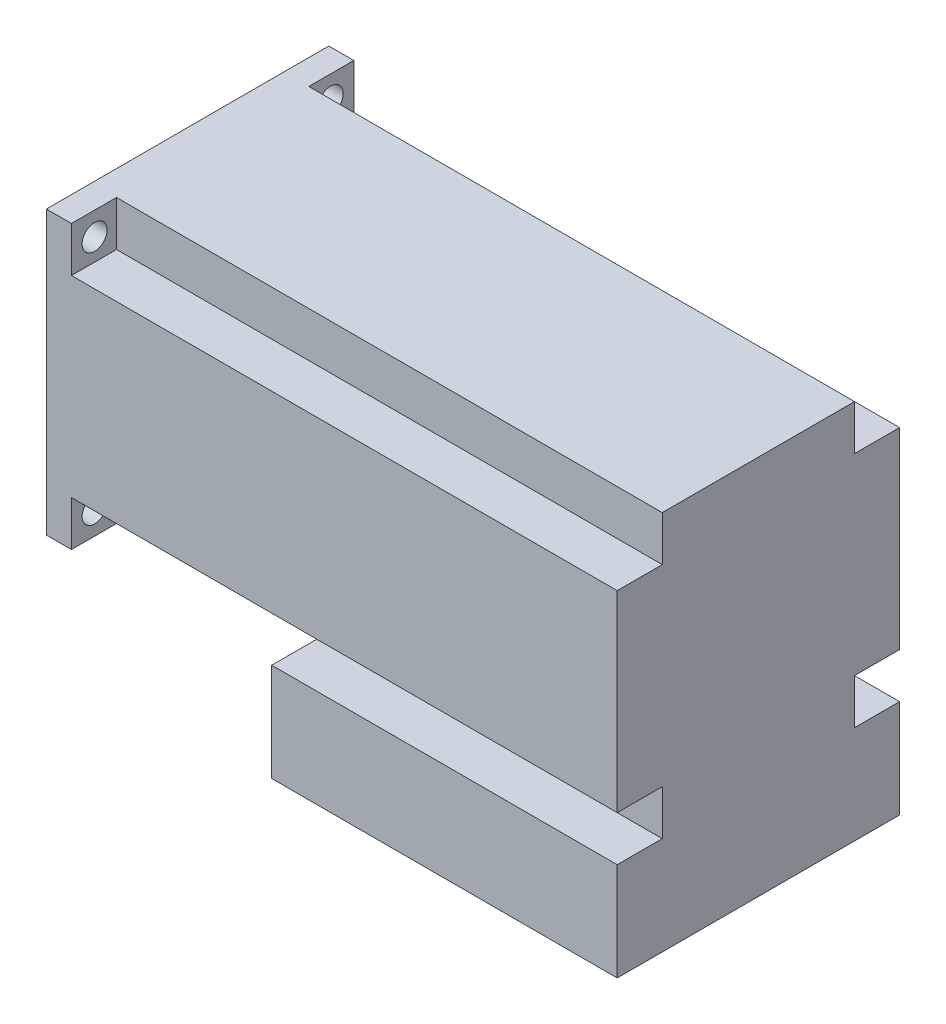
from build123d import *

# Parameters (mm, degrees)
BOSS_EXTRUDE1_DEPTH = 56.4
SKETCH2_R           = 2.5
CUT_EXTRUDE1_DEPTH  = 5
SKETCH3_R           = 3.175
BOSS_EXTRUDE2_DEPTH = 20
SKETCH4_W           = 9
SKETCH4_H           = 9
CUT_EXTRUDE2_DEPTH  = 109


with BuildPart() as part:
    # Sketch1 → Boss-Extrude1 (new body)
    with BuildSketch(Plane.XY):
        Polygon((45, 0), (45, -19.6), (114, -19.6), (114, 0), (114, 56.4), (0, 56.4), (0, 0), align=None)
    extrude(amount=BOSS_EXTRUDE1_DEPTH)

    # Sketch2 → Cut-Extrude1 (cut)
    with BuildSketch(Plane.ZY):
        with Locations((4.63, 4.63)):
            Circle(SKETCH2_R)
        with Locations((51.77, 4.63)):
            Circle(SKETCH2_R)
        with Locations((51.77, 51.77)):
            Circle(SKETCH2_R)
        with Locations((4.63, 51.77)):
            Circle(SKETCH2_R)
    extrude(amount=-CUT_EXTRUDE1_DEPTH, mode=Mode.SUBTRACT)

    # Sketch3 → Boss-Extrude2 (add)
    with BuildSketch(Plane.ZY):
        with Locations(Location((28.2, 28.2, 0), (0, 0, 180))):
            Circle(SKETCH3_R)
    extrude(amount=BOSS_EXTRUDE2_DEPTH)

    # Sketch4 → Cut-Extrude2 (cut)
    with BuildSketch(Plane(origin=(114, 0, 0), x_dir=(0, 0, -1), z_dir=(1, 0, 0))):
        with Locations((-51.9, 51.9)):
            Rectangle(SKETCH4_W, SKETCH4_H)
        with Locations((-4.5, 51.9)):
            Rectangle(SKETCH4_W, SKETCH4_H)
        with Locations((-4.5, 4.5)):
            Rectangle(SKETCH4_W, SKETCH4_H)
        with Locations((-51.9, 4.5)):
            Rectangle(SKETCH4_W, SKETCH4_H)
    extrude(amount=-CUT_EXTRUDE2_DEPTH, mode=Mode.SUBTRACT)


solid = part.part
